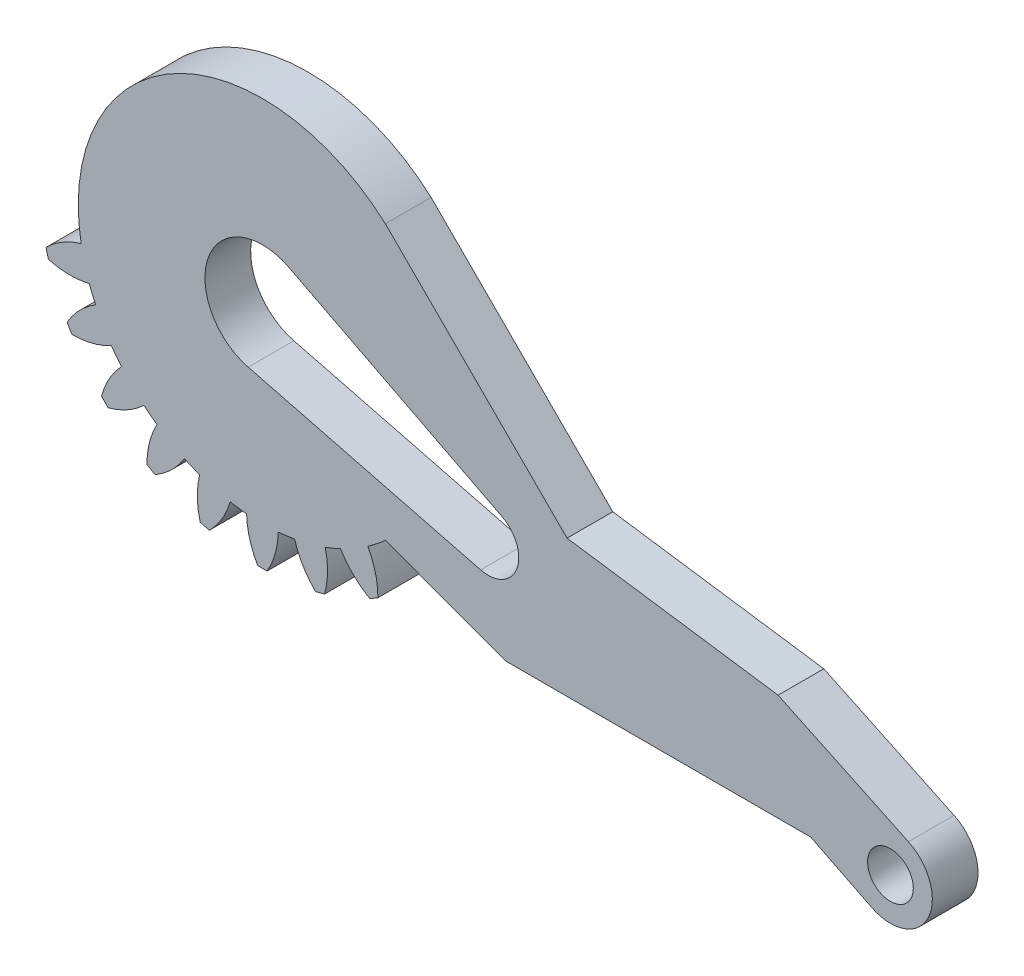
from build123d import *

# Parameters (mm, degrees)
SKETCH2_R           = 1.5
BOSS_EXTRUDE2_DEPTH = 3
CUT_EXTRUDE2_DEPTH  = 3


with BuildPart() as part:
    # Sketch2 → Boss-Extrude2 (new body)
    with BuildSketch(Plane.XY):
        with BuildLine():
            Line((33.856406461, -4.911436862), (20, -2.911436862))
            Line((20, -2.911436862), (8.072676136, 9))
            ThreePointArc((8.072676136, 9), (-5.877422545, 10.565226179), (-11.903927815, -2.112960617))
            ThreePointArc((-11.903927815, -2.112960617), (-13.14288127, -2.654199937), (-14.208555951, -3.486235477))
            ThreePointArc((-14.208555951, -3.486235477), (-14.131494839, -3.78652263), (-14.048088143, -4.085109489))
            ThreePointArc((-14.048088143, -4.085109489), (-12.709169027, -4.272836063), (-11.365584201, -4.122086336))
            ThreePointArc((-11.365584201, -4.122086336), (-11.169703548, -4.626642697), (-10.951436862, -5.12192646))
            ThreePointArc((-10.951436862, -5.12192646), (-12.008090957, -5.965388247), (-12.82210701, -7.044889767))
            ThreePointArc((-12.82210701, -7.044889767), (-12.669951657, -7.315), (-12.51210701, -7.581825517))
            ThreePointArc((-12.51210701, -7.581825517), (-11.170223244, -7.416617696), (-9.911436862, -6.9232593))
            ThreePointArc((-9.911436862, -6.9232593), (-9.591641884, -7.359925677), (-9.252623584, -7.781841479))
            ThreePointArc((-9.252623584, -7.781841479), (-10.05496909, -8.870045207), (-10.561852666, -10.123446462))
            ThreePointArc((-10.561852666, -10.123446462), (-10.344972209, -10.344972209), (-10.123446462, -10.561852666))
            ThreePointArc((-10.123446462, -10.561852666), (-8.870045207, -10.05496909), (-7.781841479, -9.252623584))
            ThreePointArc((-7.781841479, -9.252623584), (-7.359925677, -9.591641884), (-6.9232593, -9.911436862))
            ThreePointArc((-6.9232593, -9.911436862), (-7.416617696, -11.170223244), (-7.581825517, -12.51210701))
            ThreePointArc((-7.581825517, -12.51210701), (-7.315, -12.669951657), (-7.044889767, -12.82210701))
            ThreePointArc((-7.044889767, -12.82210701), (-5.965388247, -12.008090957), (-5.12192646, -10.951436862))
            ThreePointArc((-5.12192646, -10.951436862), (-4.626642697, -11.169703548), (-4.122086336, -11.365584201))
            ThreePointArc((-4.122086336, -11.365584201), (-4.272836063, -12.709169027), (-4.085109489, -14.048088143))
            ThreePointArc((-4.085109489, -14.048088143), (-3.78652263, -14.131494839), (-3.486235477, -14.208555951))
            ThreePointArc((-3.486235477, -14.208555951), (-2.654199937, -13.14288127), (-2.112960617, -11.903927815))
            ThreePointArc((-2.112960617, -11.903927815), (-1.578061664, -11.986568374), (-1.04, -12.04518576))
            ThreePointArc((-1.04, -12.04518576), (-0.837867713, -13.382005944), (-0.31, -14.626715284))
            ThreePointArc((-0.31, -14.626715284), (0, -14.63), (0.31, -14.626715284))
            ThreePointArc((0.31, -14.626715284), (0.837867713, -13.382005944), (1.04, -12.04518576))
            ThreePointArc((1.04, -12.04518576), (1.578061664, -11.986568374), (2.112960617, -11.903927815))
            ThreePointArc((2.112960617, -11.903927815), (2.654199937, -13.14288127), (3.486235477, -14.208555951))
            ThreePointArc((3.486235477, -14.208555951), (3.78652263, -14.131494839), (4.085109489, -14.048088143))
            ThreePointArc((4.085109489, -14.048088143), (4.272836063, -12.709169027), (4.122086336, -11.365584201))
            ThreePointArc((4.122086336, -11.365584201), (4.626642697, -11.169703548), (5.12192646, -10.951436862))
            ThreePointArc((5.12192646, -10.951436862), (5.965388247, -12.008090957), (7.044889767, -12.82210701))
            ThreePointArc((7.044889767, -12.82210701), (7.315, -12.669951657), (7.581825517, -12.51210701))
            ThreePointArc((7.581825517, -12.51210701), (7.416617696, -11.170223244), (6.9232593, -9.911436862))
            ThreePointArc((6.9232593, -9.911436862), (7.51180399, -9.473167412), (8.072676136, -9))
            Line((8.072676136, -9), (16, -11.911436862))
            Line((16, -11.911436862), (36, -11.911436862))
            Line((36, -11.911436862), (40, -13.911436862))
            ThreePointArc((40, -13.911436862), (43.70240259, -12.65581862), (42.40824957, -8.966708962))
            Line((42.40824957, -8.966708962), (33.856406461, -4.911436862))
        make_face()
        with Locations((41.229904242, -11.451628378)):
            Circle(SKETCH2_R, mode=Mode.SUBTRACT)
    extrude(amount=BOSS_EXTRUDE2_DEPTH)

    # Sketch4 → Cut-Extrude2 (cut)
    with BuildSketch(Plane(origin=(0, 0, 0), x_dir=(-1, 0, 0), z_dir=(0, 0, -1))):
        with BuildLine():
            Line((-1.721055129, 3.358246048), (-15.737581702, -3.825031953))
            ThreePointArc((-15.737581702, -3.825031953), (-16.698373457, -6.319012023), (-14.327181541, -7.55210013))
            Line((-14.327181541, -7.55210013), (0.933399378, -3.656311376))
            ThreePointArc((0.933399378, -3.656311376), (3.529320665, 1.335568388), (-1.721055129, 3.358246048))
        make_face()
    extrude(amount=-CUT_EXTRUDE2_DEPTH, mode=Mode.SUBTRACT)


solid = part.part
